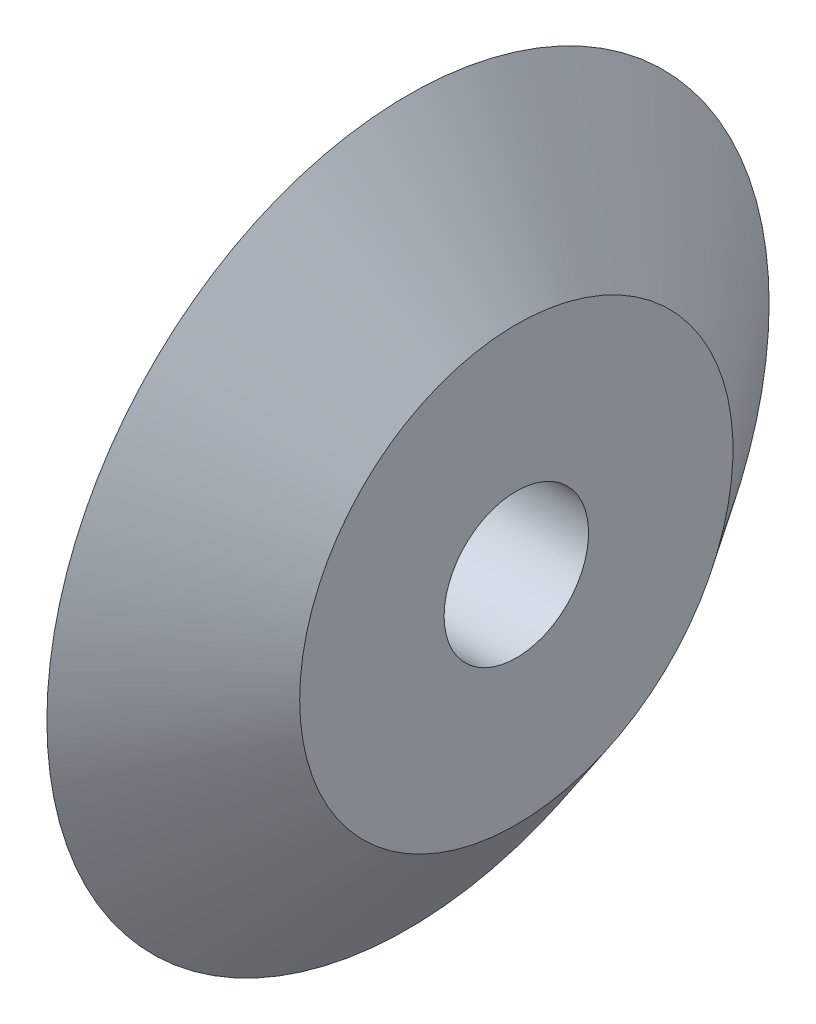
from build123d import *


with BuildPart() as part:
    # Sketch2 → Revolve1 (revolve)
    with BuildSketch(Plane.XY, mode=Mode.PRIVATE) as revolve1_sk:
        Polygon((0, 10), (0, 50), (15, 30), (15, 10), align=None)
    revolve(revolve1_sk.sketch.rotate(Axis((0, 0, 0), (1, 0, 0)), 90), axis=Axis((0, 0, 0), (1, 0, 0)))


solid = part.part
